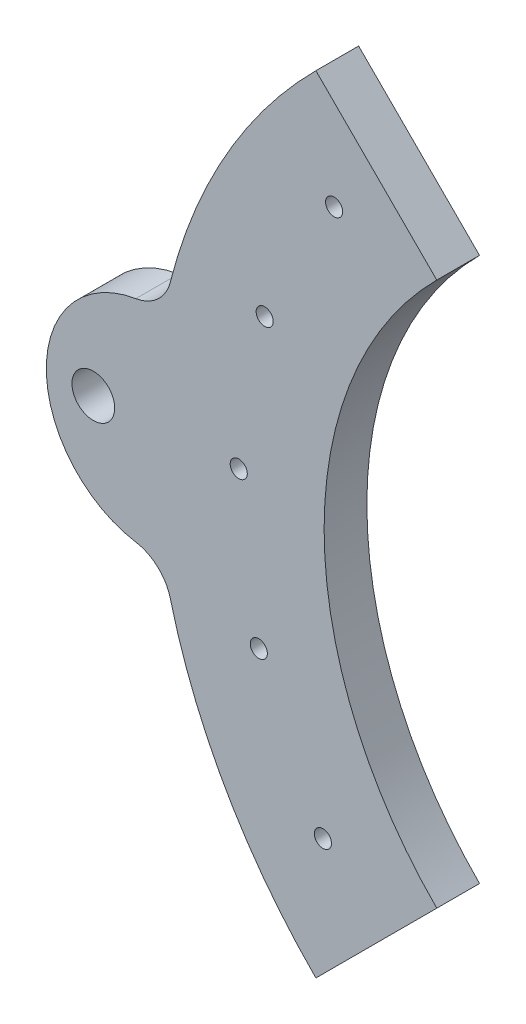
from build123d import *

# Parameters (mm, degrees)
SKETCH2_R           = 5
BOSS_EXTRUDE1_DEPTH = 10
FILLET1_R           = 10
SKETCH3_R           = 2
CUT_EXTRUDE1_DEPTH  = 181.48545662


with BuildPart() as part:
    # Sketch2 → Boss-Extrude1 (new body)
    with BuildSketch(Plane.XY):
        with BuildLine():
            Line((-63.639610307, 63.639610307), (-91.923881554, 91.923881554))
            ThreePointArc((-91.923881554, 91.923881554), (-114.764290969, 61.066828299), (-127.596153846, 24.884162105))
            ThreePointArc((-127.596153846, 24.884162105), (-155, 0), (-127.596153846, -24.884162105))
            ThreePointArc((-127.596153846, -24.884162105), (-114.764290969, -61.066828299), (-91.923881554, -91.923881554))
            Line((-91.923881554, -91.923881554), (-63.639610307, -63.639610307))
            ThreePointArc((-63.639610307, -63.639610307), (-90, 0), (-63.639610307, 63.639610307))
        make_face()
        with Locations((-144, 0)):
            Circle(SKETCH2_R, mode=Mode.SUBTRACT)
    extrude(amount=BOSS_EXTRUDE1_DEPTH)

    # Fillet1
    fillet1_edges = [part.edges().sort_by_distance(p)[0] for p in [
        (-127.596153846, -24.884162105, 5),
        (-127.596153846, 24.884162105, 5),
    ]]
    fillet(fillet1_edges, radius=FILLET1_R)

    # Sketch3 → Cut-Extrude1 (cut, through all)
    with BuildSketch(Plane.XY.offset(10)):
        with Locations((-87.661776755, 66.448573319)):
            Circle(SKETCH3_R)
        with Locations((-103.90504242, 36.107369879)):
            Circle(SKETCH3_R)
        with Locations((-109.977358585, 2.231725501)):
            Circle(SKETCH3_R)
        with Locations((-105.284324634, -31.862375719)):
            Circle(SKETCH3_R)
        with Locations((-90.285327428, -62.837565605)):
            Circle(SKETCH3_R)
    extrude(amount=-CUT_EXTRUDE1_DEPTH, mode=Mode.SUBTRACT)


solid = part.part
